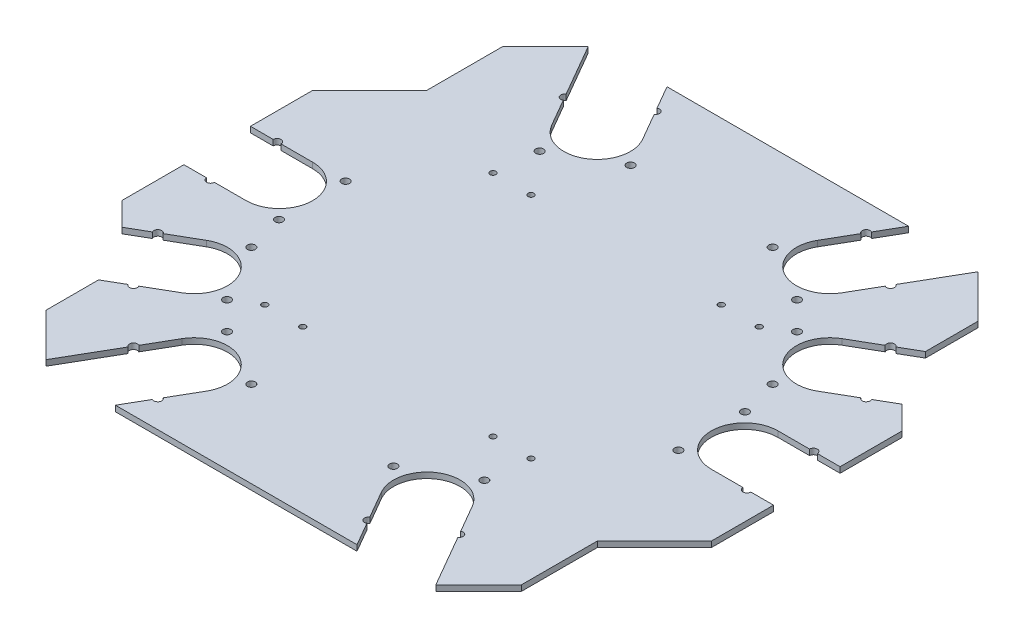
from build123d import *

# Parameters (mm, degrees)
BOSS_EXTRUDE1_DEPTH  = 3
SKETCH2_R            = 2.05
HEXCUT1_DEPTH        = 3
SKETCH5_R            = 1.55
CUT_EXTRUDE2_DEPTH   = 3
LPATTERN1_COUNT      = 2
LPATTERN1_PITCH      = 120
LPATTERN1_COUNT_DIR2 = 2
LPATTERN1_PITCH_DIR2 = 120
SKETCH6_R            = 2.05
QUADCUT1_DEPTH       = 3
CUT_EXTRUDE3_DEPTH   = 3
CUT_EXTRUDE4_DEPTH   = 3


with BuildPart() as part:
    # Sketch1 → Boss-Extrude1 (new body)
    with BuildSketch(Plane(origin=(0, 0, 0), x_dir=(1, 0, 0), z_dir=(0, 1, 0))):
        Polygon((-100, 145), (-125, 120), (-125, 80), (-155, 50), (-155, -50), (-125, -80), (-125, -120), (-100, -145), (100, -145), (125, -120), (125, -80), (155, -50), (155, 50), (125, 80), (125, 120), (100, 145), align=None)
    extrude(amount=BOSS_EXTRUDE1_DEPTH)

    # Sketch2 → HexCut1 (cut)
    with BuildSketch(Plane(origin=(0, 3, 0), x_dir=(1, 0, 0), z_dir=(0, 1, 0))):
        with Locations(Location((55.344555434, 130.859581934, 0), (0, 0, 270))):
            Circle(SKETCH2_R)
        with Locations(Location((37.344555434, 99.682667397, 0), (0, 0, 270))):
            Circle(SKETCH2_R)
        with Locations(Location((37.344555434, -99.682667397, 0), (0, 0, 270))):
            Circle(SKETCH2_R)
        with Locations(Location((55.344555434, -130.859581934, 0), (0, 0, 270))):
            Circle(SKETCH2_R)
        with Locations(Location((105, 17.5, 0), (0, 0, 270))):
            Circle(SKETCH2_R)
        with Locations(Location((141, 17.5, 0), (0, 0, 270))):
            Circle(SKETCH2_R)
        with Locations(Location((105, -17.5, 0), (0, 0, 270))):
            Circle(SKETCH2_R)
        with Locations(Location((141, -17.5, 0), (0, 0, 270))):
            Circle(SKETCH2_R)
        with Locations(Location((85.655444566, -113.359581934, 0), (0, 0, 270))):
            Circle(SKETCH2_R)
        with Locations(Location((67.655444566, -82.182667397, 0), (0, 0, 270))):
            Circle(SKETCH2_R)
        with Locations(Location((85.655444566, 113.359581934, 0), (0, 0, 270))):
            Circle(SKETCH2_R)
        with Locations(Location((67.655444566, 82.182667397, 0), (0, 0, 270))):
            Circle(SKETCH2_R)
    hexcut1 = extrude(amount=-HEXCUT1_DEPTH, mode=Mode.SUBTRACT)

    # HexCut2: HexCut1 across plane
    add(hexcut1.mirror(Plane(origin=(0, 0, 0), x_dir=(0, 0, 1), z_dir=(1, 0, 0))), mode=Mode.SUBTRACT)

    # Sketch5 → Cut-Extrude2 (cut)
    with BuildSketch(Plane(origin=(0, 3, 0), x_dir=(1, 0, 0), z_dir=(0, 1, 0))):
        with Locations(Location((50, 60, 0), (0, 0, 270))):
            Circle(SKETCH5_R)
        with Locations(Location((70, 60, 0), (0, 0, 270))):
            Circle(SKETCH5_R)
    cut_extrude2 = extrude(amount=-CUT_EXTRUDE2_DEPTH, mode=Mode.SUBTRACT)

    # LPattern1: Cut-Extrude2 2 × 2
    with Locations(*[(-j * LPATTERN1_PITCH_DIR2, 0, i * LPATTERN1_PITCH) for i in range(LPATTERN1_COUNT) for j in range(LPATTERN1_COUNT_DIR2) if (i, j) != (0, 0)]):
        add(cut_extrude2, mode=Mode.SUBTRACT)

    # Sketch6 → QuadCut1 (cut)
    with BuildSketch(Plane(origin=(0, 3, 0), x_dir=(1, 0, 0), z_dir=(0, 1, 0))):
        with Locations(Location((99.682667397, 37.344555434, 0), (0, 0, 270))):
            Circle(SKETCH6_R)
        with Locations(Location((130.859581934, 55.344555434, 0), (0, 0, 270))):
            Circle(SKETCH6_R)
        with Locations(Location((113.359581934, 85.655444566, 0), (0, 0, 270))):
            Circle(SKETCH6_R)
        with Locations(Location((82.182667397, 67.655444566, 0), (0, 0, 270))):
            Circle(SKETCH6_R)
    quadcut1 = extrude(amount=-QUADCUT1_DEPTH, mode=Mode.SUBTRACT)

    # Mirror1: QuadCut1 across plane
    add(quadcut1.mirror(Plane(origin=(0, 0, 0), x_dir=(0.5000000000000011, 0, 0.8660254037844378), z_dir=(0.8660254037844379, 0, -0.5000000000000012))), mode=Mode.SUBTRACT)

    # Sketch7 → Cut-Extrude3 (cut)
    with BuildSketch(Plane(origin=(0, 3, 0), x_dir=(1, 0, 0), z_dir=(0, 1, 0))):
        with BuildLine():
            Line((45.994555434, 114.664906883), (83.494555434, 179.616812167))
            Line((83.494555434, 179.616812167), (113.805444566, 162.116812167))
            Line((113.805444566, 162.116812167), (76.305444566, 97.164906883))
            ThreePointArc((76.305444566, 97.164906883), (52.4, 90.759462317), (45.994555434, 114.664906883))
        make_face()
        with BuildLine():
            Line((45.994555434, -114.664906883), (83.494555434, -179.616812167))
            Line((83.494555434, -179.616812167), (113.805444566, -162.116812167))
            Line((113.805444566, -162.116812167), (76.305444566, -97.164906883))
            ThreePointArc((76.305444566, -97.164906883), (52.4, -90.759462317), (45.994555434, -114.664906883))
        make_face()
        with BuildLine():
            Line((122.3, 17.5), (162.3, 17.5))
            Line((162.3, 17.5), (162.3, -17.5))
            Line((162.3, -17.5), (122.3, -17.5))
            ThreePointArc((122.3, -17.5), (104.8, 0), (122.3, 17.5))
        make_face()
    cut_extrude3 = extrude(amount=-CUT_EXTRUDE3_DEPTH, mode=Mode.SUBTRACT)

    # Mirror2: Cut-Extrude3 across plane
    add(cut_extrude3.mirror(Plane(origin=(0, 0, 0), x_dir=(0, 0, 1), z_dir=(1, 0, 0))), mode=Mode.SUBTRACT)

    # Sketch8 → Cut-Extrude4 (cut)
    with BuildSketch(Plane(origin=(0, 3, 0), x_dir=(1, 0, 0), z_dir=(0, 1, 0))):
        with BuildLine():
            Line((97.164906883, 76.305444566), (131.805923034, 96.305444566))
            Line((131.805923034, 96.305444566), (149.305923034, 65.994555434))
            Line((149.305923034, 65.994555434), (114.664906883, 45.994555434))
            ThreePointArc((114.664906883, 45.994555434), (90.759462317, 52.4), (97.164906883, 76.305444566))
        make_face()
    cut_extrude4 = extrude(amount=-CUT_EXTRUDE4_DEPTH, mode=Mode.SUBTRACT)

    # Mirror3: Cut-Extrude4 across plane
    add(cut_extrude4.mirror(Plane(origin=(0, 0, 0), x_dir=(0.5000000000000011, 0, 0.8660254037844378), z_dir=(0.8660254037844379, 0, -0.5000000000000012))), mode=Mode.SUBTRACT)


solid = part.part
